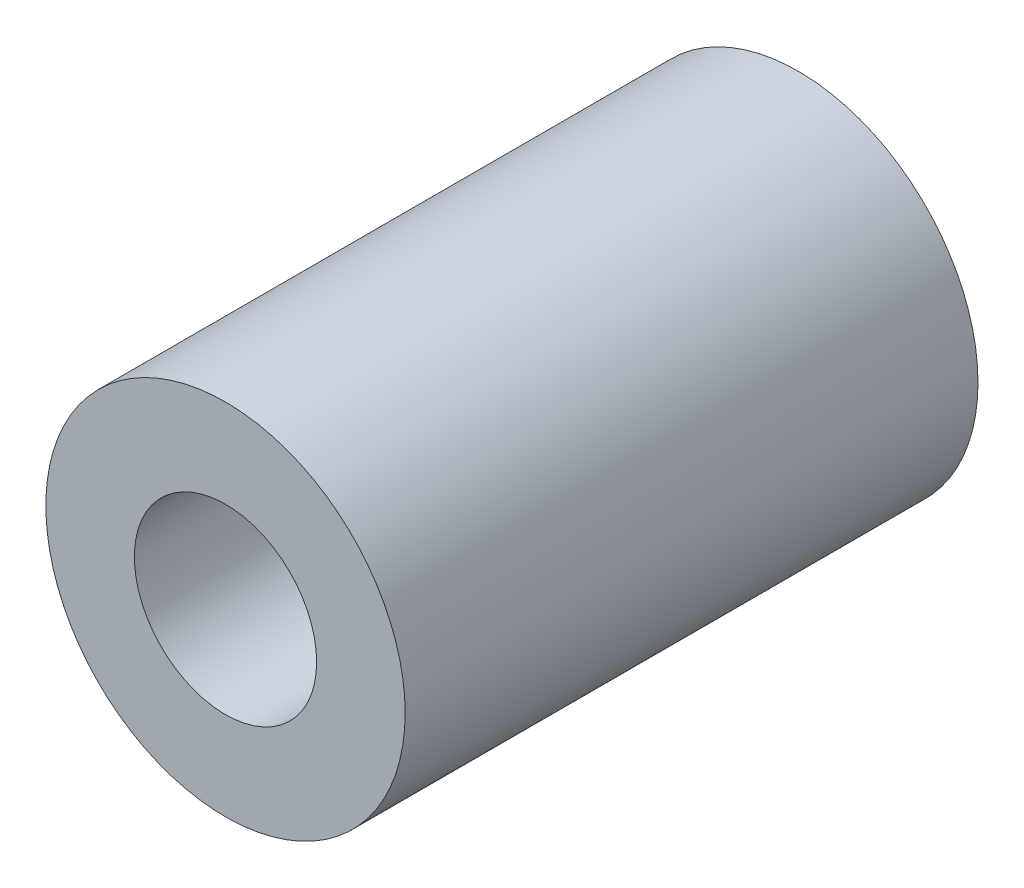
from build123d import *

# Parameters (mm, degrees)
SKETCH_1_R      = 3.45
SKETCH_1_R_2    = 1.75
EXTRUDE_1_DEPTH = 11


with BuildPart() as part:
    # ｽｹｯﾁ1 → ﾎﾞｽ - 押し出し1 (new body)
    with BuildSketch(Plane.XY):
        Circle(SKETCH_1_R)
        Circle(SKETCH_1_R_2, mode=Mode.SUBTRACT)
    extrude(amount=EXTRUDE_1_DEPTH)


solid = part.part
